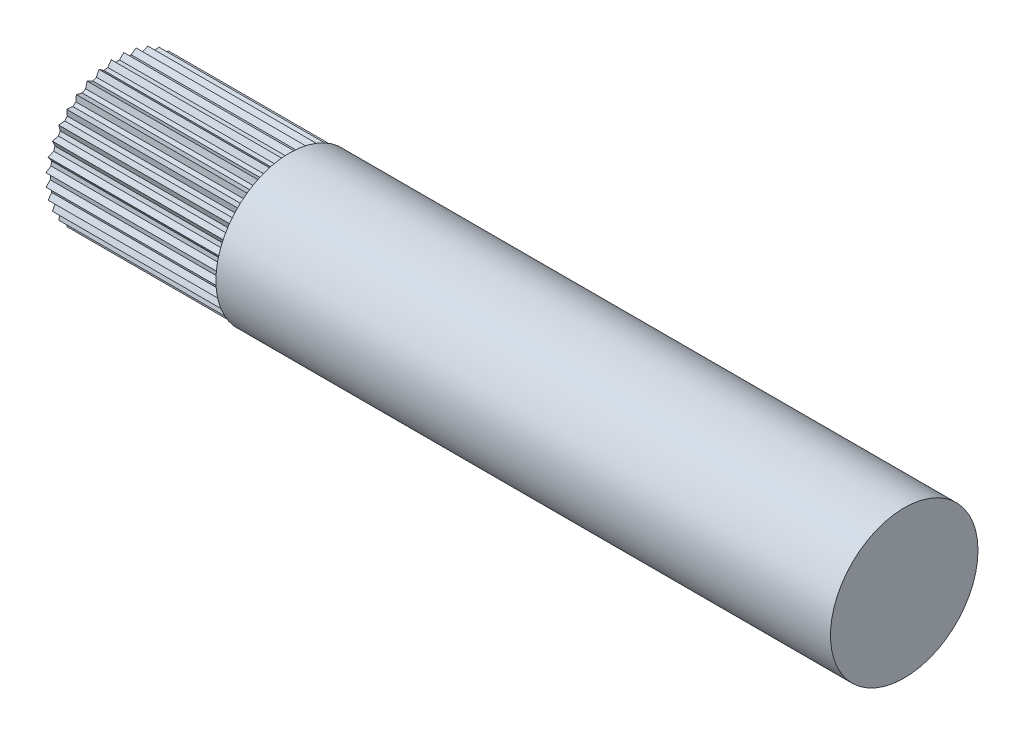
from build123d import *

# Parameters (mm, degrees)
SKETCH1_W           = 120.675
SKETCH1_H           = 1.5875
CUT_EXTRUDE2_START  = 19.25
SKETCH4_R           = 12.7
CUT_EXTRUDE2_DEPTH  = 22.225
SKETCH6_R           = 7.9375
BOSS_EXTRUDE1_DEPTH = 101.6
SKETCH7_R           = 23.308025585
CUT_EXTRUDE3_DEPTH  = 19.075


with BuildPart() as part:
    # Sketch1 → Revolve1 (revolve)
    with BuildSketch(Plane(origin=(0, 0, 0), x_dir=(1, 0, 0), z_dir=(0, 1, 0))):
        with Locations((79.5875, 8.73125)):
            Rectangle(SKETCH1_W, SKETCH1_H)
    revolve(axis=Axis((157.324, 0, 0), (-1, 0, 0)))

    # Sketch4 → Cut-Extrude2 (cut)
    with BuildSketch(Plane(origin=(0, 0, 0), x_dir=(0, 0, -1), z_dir=(1, 0, 0)).offset(CUT_EXTRUDE2_START)):
        Circle(SKETCH4_R)
        Polygon((-9.235721046, 0.808020891), (-8.681700155, 0.254), (-8.681700155, -0.254), (-9.235721046, -0.808020891), (-8.593912259, -1.257420242), (-8.505698985, -1.75770258), (-8.955098336, -2.399511367), (-8.245002688, -2.730634406), (-8.071256455, -3.207998257), (-8.402379494, -3.918093905), (-7.645572882, -4.120879625), (-7.391572882, -4.56082053), (-7.594358603, -5.317627141), (-6.813836213, -5.385914002), (-6.487300108, -5.775064579), (-6.555586968, -6.555586968), (-5.775064579, -6.487300108), (-5.385914002, -6.813836213), (-5.317627141, -7.594358603), (-4.56082053, -7.391572882), (-4.120879625, -7.645572882), (-3.918093905, -8.402379494), (-3.207998257, -8.071256455), (-2.730634406, -8.245002688), (-2.399511367, -8.955098336), (-1.75770258, -8.505698985), (-1.257420242, -8.593912259), (-0.808020891, -9.235721046), (-0.254, -8.681700155), (0.254, -8.681700155), (0.808020891, -9.235721046), (1.257420242, -8.593912259), (1.75770258, -8.505698985), (2.399511367, -8.955098336), (2.730634406, -8.245002688), (3.207998257, -8.071256455), (3.918093905, -8.402379494), (4.120879625, -7.645572882), (4.56082053, -7.391572882), (5.317627141, -7.594358603), (5.385914002, -6.813836213), (5.775064579, -6.487300108), (6.555586968, -6.555586968), (6.487300108, -5.775064579), (6.813836213, -5.385914002), (7.594358603, -5.317627141), (7.391572882, -4.56082053), (7.645572882, -4.120879625), (8.402379494, -3.918093905), (8.071256455, -3.207998257), (8.245002688, -2.730634406), (8.955098336, -2.399511367), (8.505698985, -1.75770258), (8.593912259, -1.257420242), (9.235721046, -0.808020891), (8.681700155, -0.254), (8.681700155, 0.254), (9.235721046, 0.808020891), (8.593912259, 1.257420242), (8.505698985, 1.75770258), (8.955098336, 2.399511367), (8.245002688, 2.730634406), (8.071256455, 3.207998257), (8.402379494, 3.918093905), (7.645572882, 4.120879625), (7.391572882, 4.56082053), (7.594358603, 5.317627141), (6.813836213, 5.385914002), (6.487300108, 5.775064579), (6.555586968, 6.555586968), (5.775064579, 6.487300108), (5.385914002, 6.813836213), (5.317627141, 7.594358603), (4.56082053, 7.391572882), (4.120879625, 7.645572882), (3.918093905, 8.402379494), (3.207998257, 8.071256455), (2.730634406, 8.245002688), (2.399511367, 8.955098336), (1.75770258, 8.505698985), (1.257420242, 8.593912259), (0.808020891, 9.235721046), (0.254, 8.681700155), (-0.254, 8.681700155), (-0.808020891, 9.235721046), (-1.257420242, 8.593912259), (-1.75770258, 8.505698985), (-2.399511367, 8.955098336), (-2.730634406, 8.245002688), (-3.207998257, 8.071256455), (-3.918093905, 8.402379494), (-4.120879625, 7.645572882), (-4.56082053, 7.391572882), (-5.317627141, 7.594358603), (-5.385914002, 6.813836213), (-5.775064579, 6.487300108), (-6.555586968, 6.555586968), (-6.487300108, 5.775064579), (-6.813836213, 5.385914002), (-7.594358603, 5.317627141), (-7.391572882, 4.56082053), (-7.645572882, 4.120879625), (-8.402379494, 3.918093905), (-8.071256455, 3.207998257), (-8.245002688, 2.730634406), (-8.955098336, 2.399511367), (-8.505698985, 1.75770258), (-8.593912259, 1.257420242), align=None, mode=Mode.SUBTRACT)
    extrude(amount=CUT_EXTRUDE2_DEPTH, mode=Mode.SUBTRACT)

    # Sketch6 → Boss-Extrude1 (add)
    with BuildSketch(Plane.ZY.offset(-19.25)):
        with Locations(Location((0, 0, 0), (0, 0, 180))):
            Circle(SKETCH6_R)
    extrude(amount=-BOSS_EXTRUDE1_DEPTH)

    # Sketch7 → Cut-Extrude3 (cut)
    with BuildSketch(Plane(origin=(120.85, 0, 0), x_dir=(0, 0, -1), z_dir=(1, 0, 0))):
        Circle(SKETCH7_R)
    extrude(amount=CUT_EXTRUDE3_DEPTH, mode=Mode.SUBTRACT)


solid = part.part
